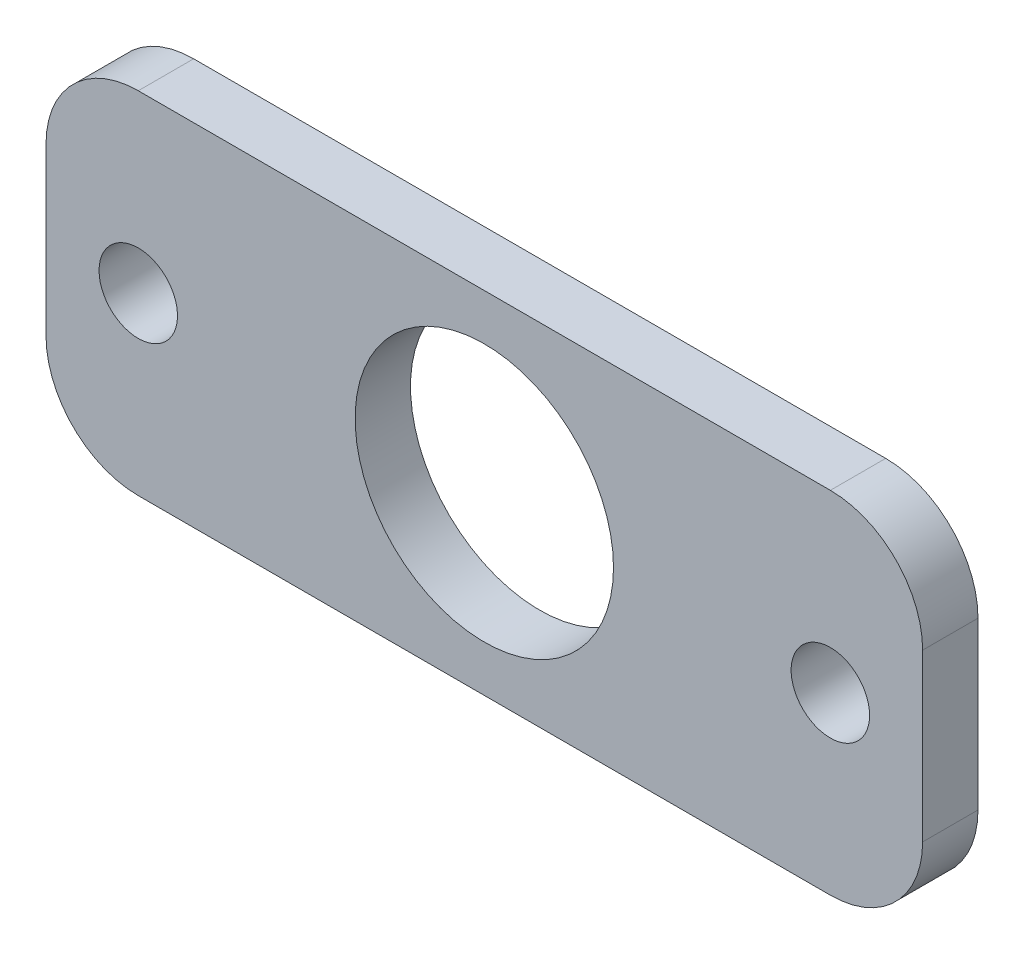
from build123d import *

# Parameters (mm, degrees)
SKETCH1_W           = 95
SKETCH1_H           = 38
SKETCH1_R           = 14
SKETCH1_R_2         = 4.25
BOSS_EXTRUDE1_DEPTH = 6
FILLET1_R           = 10


with BuildPart() as part:
    # Sketch1 → Boss-Extrude1 (new body)
    with BuildSketch(Plane.XY):
        with Locations((351.5, -19)):
            Rectangle(SKETCH1_W, SKETCH1_H)
        with Locations((351.5, -19)):
            Circle(SKETCH1_R, mode=Mode.SUBTRACT)
        with Locations((389, -19)):
            Circle(SKETCH1_R_2, mode=Mode.SUBTRACT)
        with Locations(Location((314, -19, 0), (0, 0, 180))):
            Circle(SKETCH1_R_2, mode=Mode.SUBTRACT)
    extrude(amount=BOSS_EXTRUDE1_DEPTH)

    # Fillet1
    fillet1_edges = [part.edges().sort_by_distance(p)[0] for p in [
        (399, -38, 3),
        (304, -38, 3),
        (304, 0, 3),
        (399, 0, 3),
    ]]
    fillet(fillet1_edges, radius=FILLET1_R)


solid = part.part
